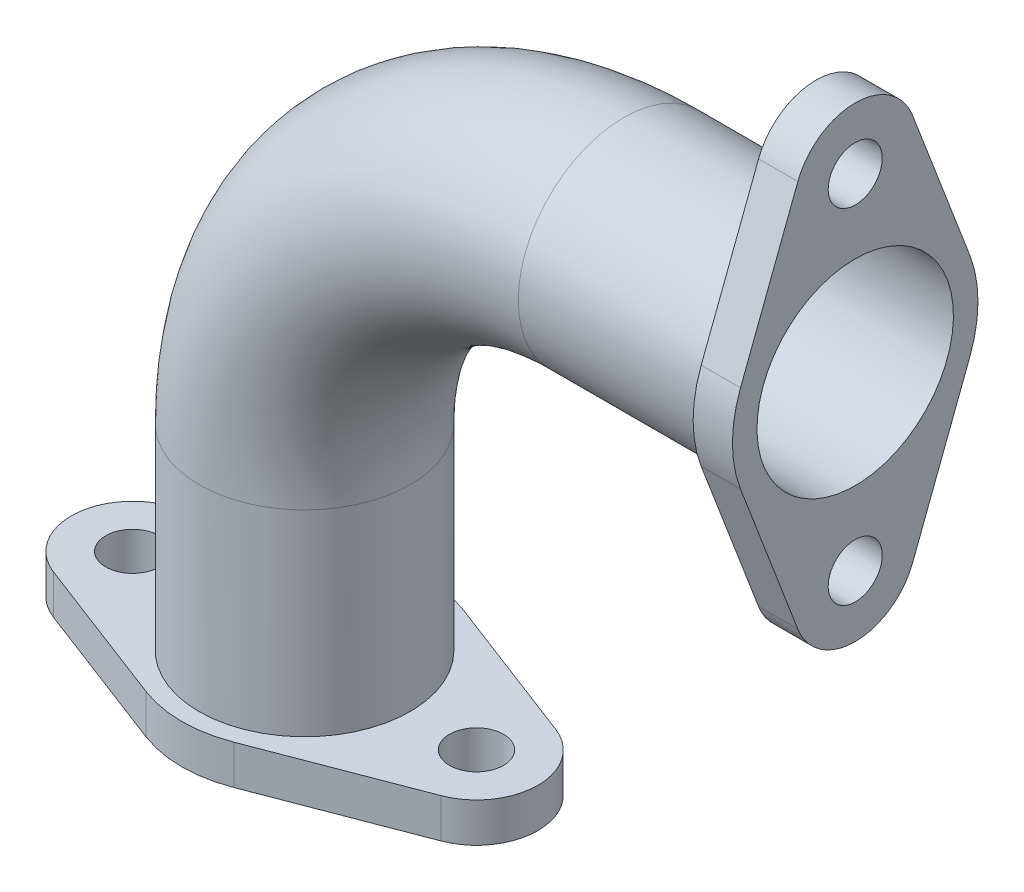
from build123d import *

# Parameters (mm, degrees)
SWEEP4_PROFILE_R     = 21.5
SKETCH21_R           = 5.5
BOSS_EXTRUDE5_DEPTH  = 8
SKETCH24_R           = 5.5
SKETCH24_R_2         = 17.5
BOSS_EXTRUDE6_DEPTH  = 8
SKETCH26_R           = 20
CUT_EXTRUDE1_DEPTH   = 48
SKETCH27_R           = 20
CUT_EXTRUDE2_DEPTH   = 48
CUT_SWEEP1_PROFILE_R = 20


with BuildPart() as part:
    # Sweep4: sweep along a path in Sketch1
    with BuildLine(Plane.XY) as sweep4_path:
        Line((40, 65), (0, 65))
        ThreePointArc((0, 65), (-45.961940777, 45.961940777), (-65, 0))
        Line((-65, 0), (-65, -40))
    # Sweep4 profile (on start of the path) → Sweep4 (sweep)
    with BuildSketch(Plane(origin=(40, 65, 0), x_dir=(0, 0, -1), z_dir=(-1, 0, 0))):
        Circle(SWEEP4_PROFILE_R)
    sweep(path=sweep4_path.line)

    # Sketch21 → Boss-Extrude5 (add)
    with BuildSketch(Plane.XZ.offset(40)):
        with BuildLine():
            Line((-104.464285714, 11.67562217), (-73.928571429, 23.35124434))
            ThreePointArc((-73.928571429, 23.35124434), (-65, 25), (-56.071428571, 23.35124434))
            Line((-56.071428571, 23.35124434), (-25.535714286, 11.67562217))
            ThreePointArc((-25.535714286, 11.67562217), (-17.5, 0), (-25.535714286, -11.67562217))
            Line((-25.535714286, -11.67562217), (-56.071428571, -23.35124434))
            ThreePointArc((-56.071428571, -23.35124434), (-65, -25), (-73.928571429, -23.35124434))
            Line((-73.928571429, -23.35124434), (-104.464285714, -11.67562217))
            ThreePointArc((-104.464285714, -11.67562217), (-112.5, 0), (-104.464285714, 11.67562217))
        make_face()
        with Locations((-100, 0)):
            Circle(SKETCH21_R, mode=Mode.SUBTRACT)
        with Locations((-30, 0)):
            Circle(SKETCH21_R, mode=Mode.SUBTRACT)
    extrude(amount=BOSS_EXTRUDE5_DEPTH)

    # Sketch24 → Boss-Extrude6 (add)
    with BuildSketch(Plane(origin=(40, 0, 0), x_dir=(0, 0, -1), z_dir=(1, 0, 0))):
        with BuildLine():
            Line((-12.573810861, 26.563231974), (-24.249433031, 57.09894626))
            ThreePointArc((-24.249433031, 57.09894626), (-25.898188691, 66.027517688), (-24.249433031, 74.956089117))
            Line((-24.249433031, 74.956089117), (-12.573810861, 105.491803403))
            ThreePointArc((-12.573810861, 105.491803403), (-0.898188691, 113.527517688), (10.77743348, 105.491803403))
            Line((10.77743348, 105.491803403), (22.45305565, 74.956089117))
            ThreePointArc((22.45305565, 74.956089117), (24.101811309, 66.027517688), (22.45305565, 57.09894626))
            Line((22.45305565, 57.09894626), (10.77743348, 26.563231974))
            ThreePointArc((10.77743348, 26.563231974), (-0.898188691, 18.527517688), (-12.573810861, 26.563231974))
        make_face()
        with Locations(Location((-0.898188691, 31.027517688, 0), (0, 0, 90))):
            Circle(SKETCH24_R, mode=Mode.SUBTRACT)
        with Locations((-0.898188691, 66.027517688)):
            Circle(SKETCH24_R_2, mode=Mode.SUBTRACT)
        with Locations(Location((-0.898188691, 101.027517688, 0), (0, 0, 90))):
            Circle(SKETCH24_R, mode=Mode.SUBTRACT)
    extrude(amount=BOSS_EXTRUDE6_DEPTH)

    # Sketch26 → Cut-Extrude1 (cut)
    with BuildSketch(Plane.XZ.offset(48)):
        with Locations((-65, 0)):
            Circle(SKETCH26_R)
    extrude(amount=-CUT_EXTRUDE1_DEPTH, mode=Mode.SUBTRACT)

    # Sketch27 → Cut-Extrude2 (cut)
    with BuildSketch(Plane(origin=(48, 0, 0), x_dir=(0, 0, -1), z_dir=(1, 0, 0))):
        with Locations(Location((-0.898188691, 66.027517688, 0), (0, 0, 90))):
            Circle(SKETCH27_R)
    extrude(amount=-CUT_EXTRUDE2_DEPTH, mode=Mode.SUBTRACT)

    # Cut-Sweep1: sweep along a path in Sketch28
    with BuildLine(Plane.XY) as cut_sweep1_path:
        ThreePointArc((0, 65), (-45.961940777, 45.961940777), (-65, 0))
    # Cut-Sweep1 profile (on start of the path) → Cut-Sweep1 (sweep, cut)
    with BuildSketch(Plane(origin=(0, 65, 0), x_dir=(0, -1, 0), z_dir=(-1, 0, 0))):
        Circle(CUT_SWEEP1_PROFILE_R)
    sweep(path=cut_sweep1_path.line, mode=Mode.SUBTRACT)


solid = part.part
